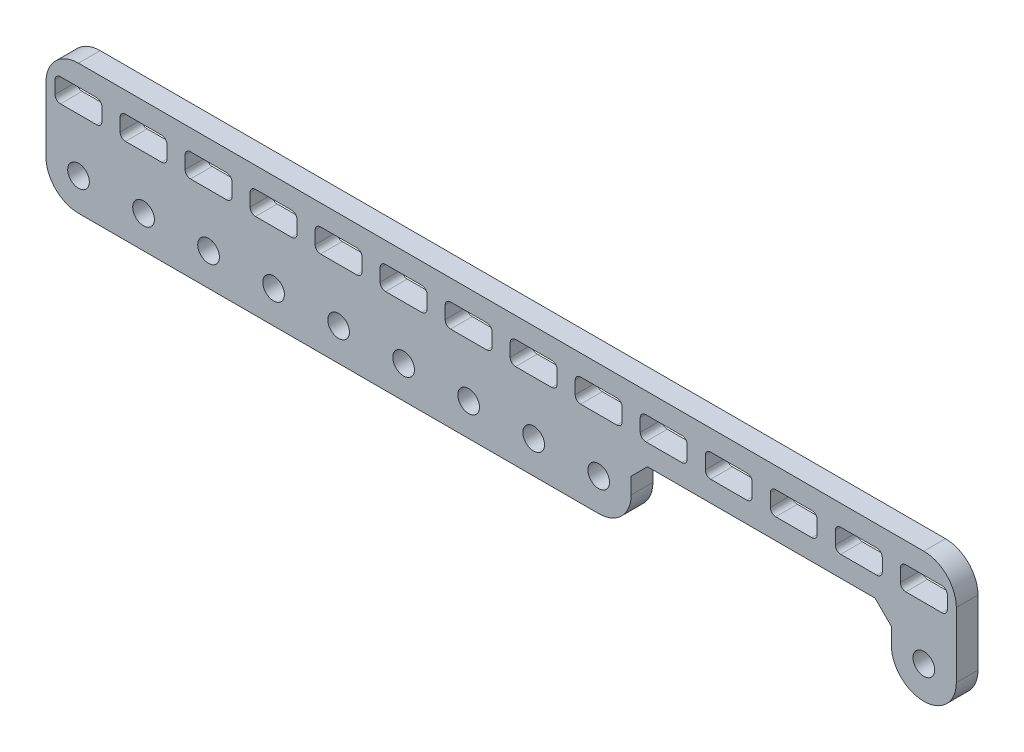
from build123d import *

# Parameters (mm, degrees)
MODEL_R                 = 1.5
SALIENTE_EXTRUIR1_DEPTH = 3


with BuildPart() as part:
    # Model → Saliente-Extruir1 (new body)
    with BuildSketch(Plane.XY):
        with BuildLine():
            Line((238.429131311, 228.742243614), (355.429131311, 228.742243614))
            ThreePointArc((355.429131311, 228.742243614), (358.611111826, 227.424224129), (359.929131311, 224.242243614))
            Line((359.929131311, 224.242243614), (359.929131311, 215.242243614))
            ThreePointArc((359.929131311, 215.242243614), (355.429131311, 210.742243614), (350.929131311, 215.242243614))
            Line((350.929131311, 215.242243614), (350.929131311, 217.492243614))
            Line((350.929131311, 217.492243614), (348.679131311, 219.742243614))
            Line((348.679131311, 219.742243614), (317.179131311, 219.742243614))
            Line((317.179131311, 219.742243614), (314.929131311, 217.492243614))
            Line((314.929131311, 217.492243614), (314.929131311, 215.242243614))
            ThreePointArc((314.929131311, 215.242243614), (313.611111826, 212.060263099), (310.429131311, 210.742243614))
            Line((310.429131311, 210.742243614), (238.429131311, 210.742243614))
            ThreePointArc((238.429131311, 210.742243614), (235.247150795, 212.060263099), (233.929131311, 215.242243614))
            Line((233.929131311, 215.242243614), (233.929131311, 224.242243614))
            ThreePointArc((233.929131311, 224.242243614), (235.247150795, 227.424224129), (238.429131311, 228.742243614))
        make_face()
        with Locations((310.429131311, 215.242243614)):
            Circle(MODEL_R, mode=Mode.SUBTRACT)
        with Locations((292.429131311, 215.242243614)):
            Circle(MODEL_R, mode=Mode.SUBTRACT)
        with Locations((301.429131311, 215.242243614)):
            Circle(MODEL_R, mode=Mode.SUBTRACT)
        with Locations((274.429131311, 215.242243614)):
            Circle(MODEL_R, mode=Mode.SUBTRACT)
        with Locations((283.429131311, 215.242243614)):
            Circle(MODEL_R, mode=Mode.SUBTRACT)
        with Locations((247.429131311, 215.242243614)):
            Circle(MODEL_R, mode=Mode.SUBTRACT)
        with Locations((238.429131311, 215.242243614)):
            Circle(MODEL_R, mode=Mode.SUBTRACT)
        with Locations((355.429131311, 215.242243614)):
            Circle(MODEL_R, mode=Mode.SUBTRACT)
        with Locations((265.429131311, 215.242243614)):
            Circle(MODEL_R, mode=Mode.SUBTRACT)
        with Locations((256.429131311, 215.242243614)):
            Circle(MODEL_R, mode=Mode.SUBTRACT)
        with BuildLine():
            Line((249.929131311, 222.617243614), (244.929131311, 222.617243614))
            ThreePointArc((244.929131311, 222.617243614), (244.398801225, 222.836913528), (244.179131311, 223.367243614))
            Line((244.179131311, 223.367243614), (244.179131311, 225.117243614))
            ThreePointArc((244.179131311, 225.117243614), (244.398801225, 225.6475737), (244.929131311, 225.867243614))
            Line((244.929131311, 225.867243614), (249.929131311, 225.867243614))
            ThreePointArc((249.929131311, 225.867243614), (250.459461397, 225.6475737), (250.679131311, 225.117243614))
            Line((250.679131311, 225.117243614), (250.679131311, 223.367243614))
            ThreePointArc((250.679131311, 223.367243614), (250.459461397, 222.836913528), (249.929131311, 222.617243614))
        make_face(mode=Mode.SUBTRACT)
        with BuildLine():
            Line((285.929131311, 222.617243614), (280.929131311, 222.617243614))
            ThreePointArc((280.929131311, 222.617243614), (280.398801225, 222.836913528), (280.179131311, 223.367243614))
            Line((280.179131311, 223.367243614), (280.179131311, 225.117243614))
            ThreePointArc((280.179131311, 225.117243614), (280.398801225, 225.6475737), (280.929131311, 225.867243614))
            Line((280.929131311, 225.867243614), (285.929131311, 225.867243614))
            ThreePointArc((285.929131311, 225.867243614), (286.459461397, 225.6475737), (286.679131311, 225.117243614))
            Line((286.679131311, 225.117243614), (286.679131311, 223.367243614))
            ThreePointArc((286.679131311, 223.367243614), (286.459461397, 222.836913528), (285.929131311, 222.617243614))
        make_face(mode=Mode.SUBTRACT)
        with BuildLine():
            Line((240.929131311, 222.617243614), (235.929131311, 222.617243614))
            ThreePointArc((235.929131311, 222.617243614), (235.398801225, 222.836913528), (235.179131311, 223.367243614))
            Line((235.179131311, 223.367243614), (235.179131311, 225.117243614))
            ThreePointArc((235.179131311, 225.117243614), (235.398801225, 225.6475737), (235.929131311, 225.867243614))
            Line((235.929131311, 225.867243614), (240.929131311, 225.867243614))
            ThreePointArc((240.929131311, 225.867243614), (241.459461397, 225.6475737), (241.679131311, 225.117243614))
            Line((241.679131311, 225.117243614), (241.679131311, 223.367243614))
            ThreePointArc((241.679131311, 223.367243614), (241.459461397, 222.836913528), (240.929131311, 222.617243614))
        make_face(mode=Mode.SUBTRACT)
        with BuildLine():
            Line((276.929131311, 222.617243614), (271.929131311, 222.617243614))
            ThreePointArc((271.929131311, 222.617243614), (271.398801225, 222.836913528), (271.179131311, 223.367243614))
            Line((271.179131311, 223.367243614), (271.179131311, 225.117243614))
            ThreePointArc((271.179131311, 225.117243614), (271.398801225, 225.6475737), (271.929131311, 225.867243614))
            Line((271.929131311, 225.867243614), (276.929131311, 225.867243614))
            ThreePointArc((276.929131311, 225.867243614), (277.459461397, 225.6475737), (277.679131311, 225.117243614))
            Line((277.679131311, 225.117243614), (277.679131311, 223.367243614))
            ThreePointArc((277.679131311, 223.367243614), (277.459461397, 222.836913528), (276.929131311, 222.617243614))
        make_face(mode=Mode.SUBTRACT)
        with BuildLine():
            Line((294.929131311, 222.617243614), (289.929131311, 222.617243614))
            ThreePointArc((289.929131311, 222.617243614), (289.398801225, 222.836913528), (289.179131311, 223.367243614))
            Line((289.179131311, 223.367243614), (289.179131311, 225.117243614))
            ThreePointArc((289.179131311, 225.117243614), (289.398801225, 225.6475737), (289.929131311, 225.867243614))
            Line((289.929131311, 225.867243614), (294.929131311, 225.867243614))
            ThreePointArc((294.929131311, 225.867243614), (295.459461397, 225.6475737), (295.679131311, 225.117243614))
            Line((295.679131311, 225.117243614), (295.679131311, 223.367243614))
            ThreePointArc((295.679131311, 223.367243614), (295.459461397, 222.836913528), (294.929131311, 222.617243614))
        make_face(mode=Mode.SUBTRACT)
        with BuildLine():
            Line((303.929131311, 222.617243614), (298.929131311, 222.617243614))
            ThreePointArc((298.929131311, 222.617243614), (298.398801225, 222.836913528), (298.179131311, 223.367243614))
            Line((298.179131311, 223.367243614), (298.179131311, 225.117243614))
            ThreePointArc((298.179131311, 225.117243614), (298.398801225, 225.6475737), (298.929131311, 225.867243614))
            Line((298.929131311, 225.867243614), (303.929131311, 225.867243614))
            ThreePointArc((303.929131311, 225.867243614), (304.459461397, 225.6475737), (304.679131311, 225.117243614))
            Line((304.679131311, 225.117243614), (304.679131311, 223.367243614))
            ThreePointArc((304.679131311, 223.367243614), (304.459461397, 222.836913528), (303.929131311, 222.617243614))
        make_face(mode=Mode.SUBTRACT)
        with BuildLine():
            Line((321.929131311, 222.617243614), (316.929131311, 222.617243614))
            ThreePointArc((316.929131311, 222.617243614), (316.398801225, 222.836913528), (316.179131311, 223.367243614))
            Line((316.179131311, 223.367243614), (316.179131311, 225.117243614))
            ThreePointArc((316.179131311, 225.117243614), (316.398801225, 225.6475737), (316.929131311, 225.867243614))
            Line((316.929131311, 225.867243614), (321.929131311, 225.867243614))
            ThreePointArc((321.929131311, 225.867243614), (322.459461397, 225.6475737), (322.679131311, 225.117243614))
            Line((322.679131311, 225.117243614), (322.679131311, 223.367243614))
            ThreePointArc((322.679131311, 223.367243614), (322.459461397, 222.836913528), (321.929131311, 222.617243614))
        make_face(mode=Mode.SUBTRACT)
        with BuildLine():
            Line((312.929131311, 222.617243614), (307.929131311, 222.617243614))
            ThreePointArc((307.929131311, 222.617243614), (307.398801225, 222.836913528), (307.179131311, 223.367243614))
            Line((307.179131311, 223.367243614), (307.179131311, 225.117243614))
            ThreePointArc((307.179131311, 225.117243614), (307.398801225, 225.6475737), (307.929131311, 225.867243614))
            Line((307.929131311, 225.867243614), (312.929131311, 225.867243614))
            ThreePointArc((312.929131311, 225.867243614), (313.459461397, 225.6475737), (313.679131311, 225.117243614))
            Line((313.679131311, 225.117243614), (313.679131311, 223.367243614))
            ThreePointArc((313.679131311, 223.367243614), (313.459461397, 222.836913528), (312.929131311, 222.617243614))
        make_face(mode=Mode.SUBTRACT)
        with BuildLine():
            Line((357.929131311, 222.617243614), (352.929131311, 222.617243614))
            ThreePointArc((352.929131311, 222.617243614), (352.398801225, 222.836913528), (352.179131311, 223.367243614))
            Line((352.179131311, 223.367243614), (352.179131311, 225.117243614))
            ThreePointArc((352.179131311, 225.117243614), (352.398801225, 225.6475737), (352.929131311, 225.867243614))
            Line((352.929131311, 225.867243614), (357.929131311, 225.867243614))
            ThreePointArc((357.929131311, 225.867243614), (358.459461397, 225.6475737), (358.679131311, 225.117243614))
            Line((358.679131311, 225.117243614), (358.679131311, 223.367243614))
            ThreePointArc((358.679131311, 223.367243614), (358.459461397, 222.836913528), (357.929131311, 222.617243614))
        make_face(mode=Mode.SUBTRACT)
        with BuildLine():
            Line((348.929131311, 222.617243614), (343.929131311, 222.617243614))
            ThreePointArc((343.929131311, 222.617243614), (343.398801225, 222.836913528), (343.179131311, 223.367243614))
            Line((343.179131311, 223.367243614), (343.179131311, 225.117243614))
            ThreePointArc((343.179131311, 225.117243614), (343.398801225, 225.6475737), (343.929131311, 225.867243614))
            Line((343.929131311, 225.867243614), (348.929131311, 225.867243614))
            ThreePointArc((348.929131311, 225.867243614), (349.459461397, 225.6475737), (349.679131311, 225.117243614))
            Line((349.679131311, 225.117243614), (349.679131311, 223.367243614))
            ThreePointArc((349.679131311, 223.367243614), (349.459461397, 222.836913528), (348.929131311, 222.617243614))
        make_face(mode=Mode.SUBTRACT)
        with BuildLine():
            Line((339.929131311, 222.617243614), (334.929131311, 222.617243614))
            ThreePointArc((334.929131311, 222.617243614), (334.398801225, 222.836913528), (334.179131311, 223.367243614))
            Line((334.179131311, 223.367243614), (334.179131311, 225.117243614))
            ThreePointArc((334.179131311, 225.117243614), (334.398801225, 225.6475737), (334.929131311, 225.867243614))
            Line((334.929131311, 225.867243614), (339.929131311, 225.867243614))
            ThreePointArc((339.929131311, 225.867243614), (340.459461397, 225.6475737), (340.679131311, 225.117243614))
            Line((340.679131311, 225.117243614), (340.679131311, 223.367243614))
            ThreePointArc((340.679131311, 223.367243614), (340.459461397, 222.836913528), (339.929131311, 222.617243614))
        make_face(mode=Mode.SUBTRACT)
        with BuildLine():
            Line((330.929131311, 222.617243614), (325.929131311, 222.617243614))
            ThreePointArc((325.929131311, 222.617243614), (325.398801225, 222.836913528), (325.179131311, 223.367243614))
            Line((325.179131311, 223.367243614), (325.179131311, 225.117243614))
            ThreePointArc((325.179131311, 225.117243614), (325.398801225, 225.6475737), (325.929131311, 225.867243614))
            Line((325.929131311, 225.867243614), (330.929131311, 225.867243614))
            ThreePointArc((330.929131311, 225.867243614), (331.459461397, 225.6475737), (331.679131311, 225.117243614))
            Line((331.679131311, 225.117243614), (331.679131311, 223.367243614))
            ThreePointArc((331.679131311, 223.367243614), (331.459461397, 222.836913528), (330.929131311, 222.617243614))
        make_face(mode=Mode.SUBTRACT)
        with BuildLine():
            Line((267.929131311, 222.617243614), (262.929131311, 222.617243614))
            ThreePointArc((262.929131311, 222.617243614), (262.398801225, 222.836913528), (262.179131311, 223.367243614))
            Line((262.179131311, 223.367243614), (262.179131311, 225.117243614))
            ThreePointArc((262.179131311, 225.117243614), (262.398801225, 225.6475737), (262.929131311, 225.867243614))
            Line((262.929131311, 225.867243614), (267.929131311, 225.867243614))
            ThreePointArc((267.929131311, 225.867243614), (268.459461397, 225.6475737), (268.679131311, 225.117243614))
            Line((268.679131311, 225.117243614), (268.679131311, 223.367243614))
            ThreePointArc((268.679131311, 223.367243614), (268.459461397, 222.836913528), (267.929131311, 222.617243614))
        make_face(mode=Mode.SUBTRACT)
        with BuildLine():
            Line((258.929131311, 222.617243614), (253.929131311, 222.617243614))
            ThreePointArc((253.929131311, 222.617243614), (253.398801225, 222.836913528), (253.179131311, 223.367243614))
            Line((253.179131311, 223.367243614), (253.179131311, 225.117243614))
            ThreePointArc((253.179131311, 225.117243614), (253.398801225, 225.6475737), (253.929131311, 225.867243614))
            Line((253.929131311, 225.867243614), (258.929131311, 225.867243614))
            ThreePointArc((258.929131311, 225.867243614), (259.459461397, 225.6475737), (259.679131311, 225.117243614))
            Line((259.679131311, 225.117243614), (259.679131311, 223.367243614))
            ThreePointArc((259.679131311, 223.367243614), (259.459461397, 222.836913528), (258.929131311, 222.617243614))
        make_face(mode=Mode.SUBTRACT)
    extrude(amount=SALIENTE_EXTRUIR1_DEPTH)


solid = part.part
